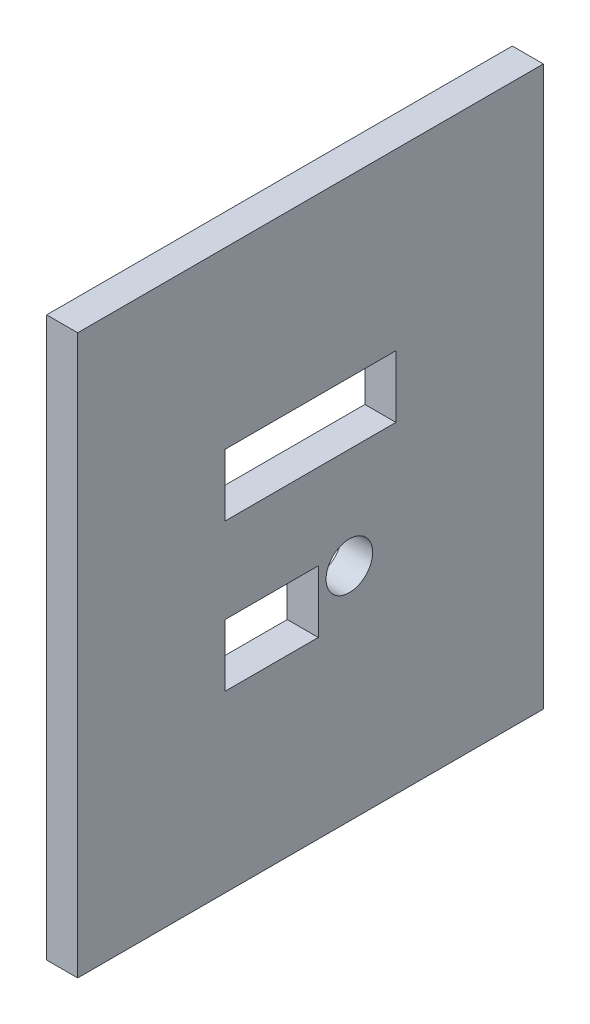
from build123d import *

# Parameters (mm, degrees)
SKETCH1_W           = 30
SKETCH1_H           = 36
BOSS_EXTRUDE1_DEPTH = 2
SKETCH2_W           = 11
SKETCH2_H           = 4
SKETCH2_W_2         = 6
SKETCH2_R           = 1.5
CUT_EXTRUDE2_DEPTH  = 10


with BuildPart() as part:
    # Sketch1 → Boss-Extrude1 (new body)
    with BuildSketch(Plane(origin=(0, 0, 0), x_dir=(0, 0, -1), z_dir=(1, 0, 0))):
        Rectangle(SKETCH1_W, SKETCH1_H)
    extrude(amount=BOSS_EXTRUDE1_DEPTH)

    # Sketch2 → Cut-Extrude2 (cut)
    with BuildSketch(Plane(origin=(2, 0, 0), x_dir=(0, 0, -1), z_dir=(1, 0, 0))):
        with Locations((0, 4.75)):
            Rectangle(SKETCH2_W, SKETCH2_H)
        with Locations((-2.5, -4.75)):
            Rectangle(SKETCH2_W_2, SKETCH2_H)
        with Locations((2.5, -3.75)):
            Circle(SKETCH2_R)
    extrude(amount=-CUT_EXTRUDE2_DEPTH, mode=Mode.SUBTRACT)


solid = part.part
